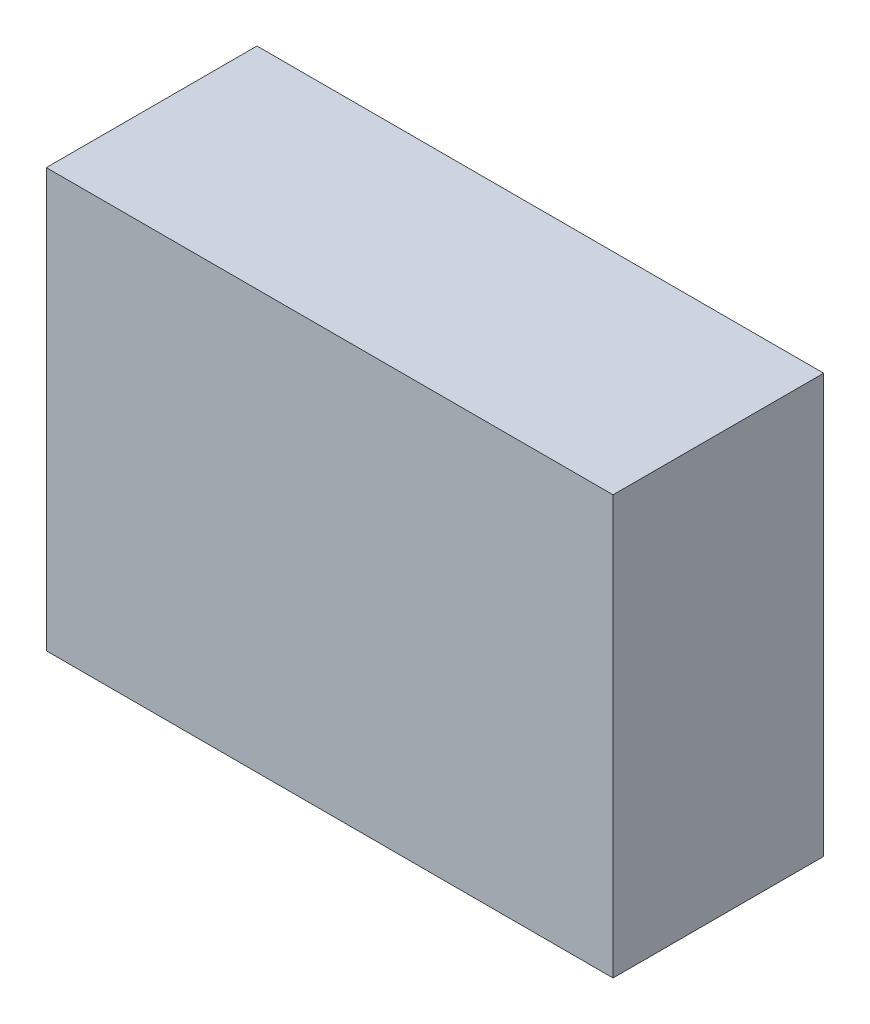
from build123d import *

# Parameters (mm, degrees)
SKETCH1_W           = 4.09
SKETCH1_H           = 3.02
BOSS_EXTRUDE1_DEPTH = 1.52


with BuildPart() as part:
    # Sketch1 → Boss-Extrude1 (new body)
    with BuildSketch(Plane.XY):
        with Locations((2.045, 1.51)):
            Rectangle(SKETCH1_W, SKETCH1_H)
    extrude(amount=BOSS_EXTRUDE1_DEPTH)


solid = part.part
